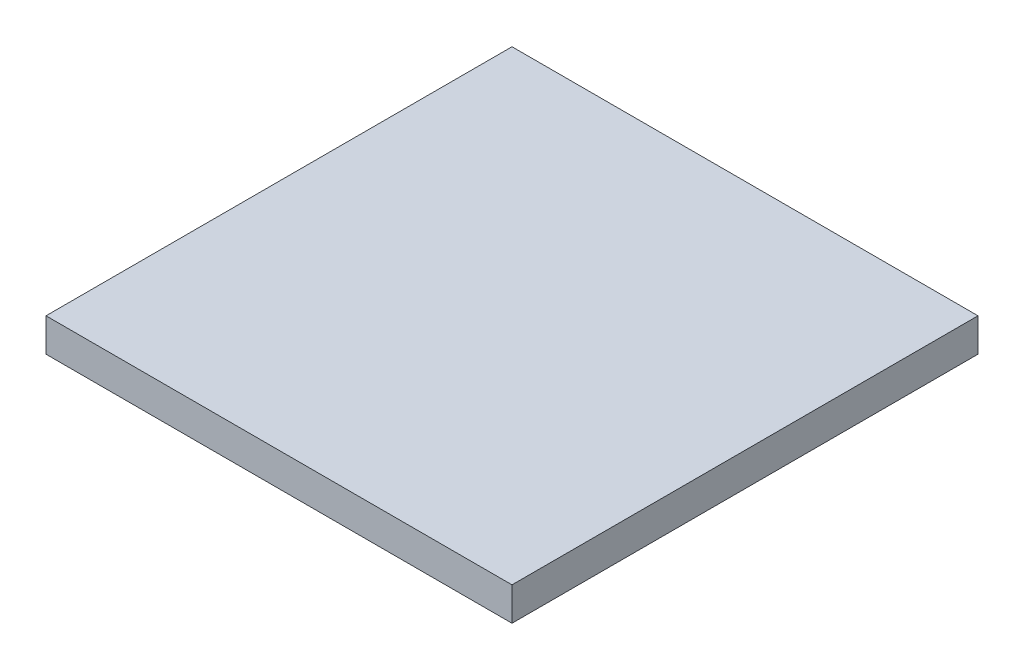
from build123d import *

# Parameters (mm, degrees)
SKETCH1_W           = 14
SKETCH1_H           = 14
BOSS_EXTRUDE1_DEPTH = 1


with BuildPart() as part:
    # Sketch1 → Boss-Extrude1 (new body)
    with BuildSketch(Plane(origin=(0, 0, 0), x_dir=(1, 0, 0), z_dir=(0, 1, 0))):
        with Locations((7, -7)):
            Rectangle(SKETCH1_W, SKETCH1_H)
    extrude(amount=BOSS_EXTRUDE1_DEPTH)


solid = part.part
